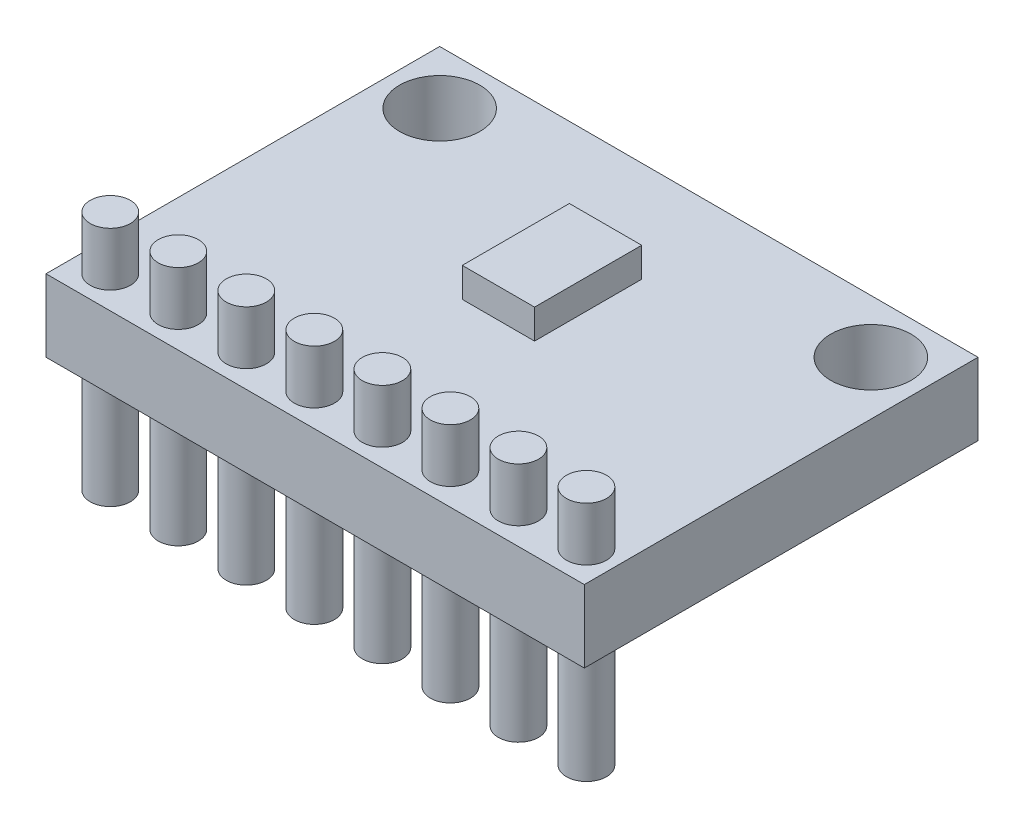
from build123d import *

# Parameters (mm, degrees)
SKETCH1_W                = 20.1
SKETCH1_H                = 14.7
BOSS_EXTRUDE1_DEPTH      = 2.7
BOSS_EXTRUDE2_DEPTH      = 2
BOSS_EXTRUDE2_DEPTH_BACK = 7
SKETCH2_R                = 0.75
SKETCH3_R                = 1.5
CUT_EXTRUDE1_DEPTH       = 15.283732005
SKETCH4_W                = 2.7
SKETCH4_H                = 4
BOSS_EXTRUDE3_DEPTH      = 1.1


with BuildPart() as part:
    # Sketch1 → Boss-Extrude1 (new body)
    with BuildSketch(Plane(origin=(0, 0, 0), x_dir=(1, 0, 0), z_dir=(0, 1, 0))):
        Rectangle(SKETCH1_W, SKETCH1_H)
    extrude(amount=BOSS_EXTRUDE1_DEPTH)

    # Sketch2 → Boss-Extrude2 (add, two sides: drawn at the far end of the back side and taken through both)
    with BuildSketch(Plane(origin=(0, 2.7, 0), x_dir=(1, 0, 0), z_dir=(0, 1, 0)).offset(-BOSS_EXTRUDE2_DEPTH_BACK)):
        with Locations(Location((-8.85, -6.15, 0), (0, 0, 270))):
            Circle(SKETCH2_R)
        with Locations(Location((-6.31, -6.15, 0), (0, 0, 270))):
            Circle(SKETCH2_R)
        with Locations(Location((-3.77, -6.15, 0), (0, 0, 270))):
            Circle(SKETCH2_R)
        with Locations(Location((-1.23, -6.15, 0), (0, 0, 270))):
            Circle(SKETCH2_R)
        with Locations(Location((1.31, -6.15, 0), (0, 0, 270))):
            Circle(SKETCH2_R)
        with Locations(Location((3.85, -6.15, 0), (0, 0, 270))):
            Circle(SKETCH2_R)
        with Locations(Location((6.39, -6.15, 0), (0, 0, 270))):
            Circle(SKETCH2_R)
        with Locations(Location((8.93, -6.15, 0), (0, 0, 270))):
            Circle(SKETCH2_R)
    extrude(amount=BOSS_EXTRUDE2_DEPTH + BOSS_EXTRUDE2_DEPTH_BACK)

    # Sketch3 → Cut-Extrude1 (cut, through all)
    with BuildSketch(Plane(origin=(0, 2.7, 0), x_dir=(1, 0, 0), z_dir=(0, 1, 0))):
        with Locations(Location((-8.05, 5.35, 0), (0, 0, 270))):
            Circle(SKETCH3_R)
        with Locations(Location((8.05, 5.35, 0), (0, 0, 270))):
            Circle(SKETCH3_R)
    extrude(amount=-CUT_EXTRUDE1_DEPTH, mode=Mode.SUBTRACT)

    # Sketch4 → Boss-Extrude3 (add)
    with BuildSketch(Plane(origin=(0, 2.7, 0), x_dir=(1, 0, 0), z_dir=(0, 1, 0))):
        with Locations((-0.10078743, 1.593237169)):
            Rectangle(SKETCH4_W, SKETCH4_H)
    extrude(amount=BOSS_EXTRUDE3_DEPTH)


solid = part.part
